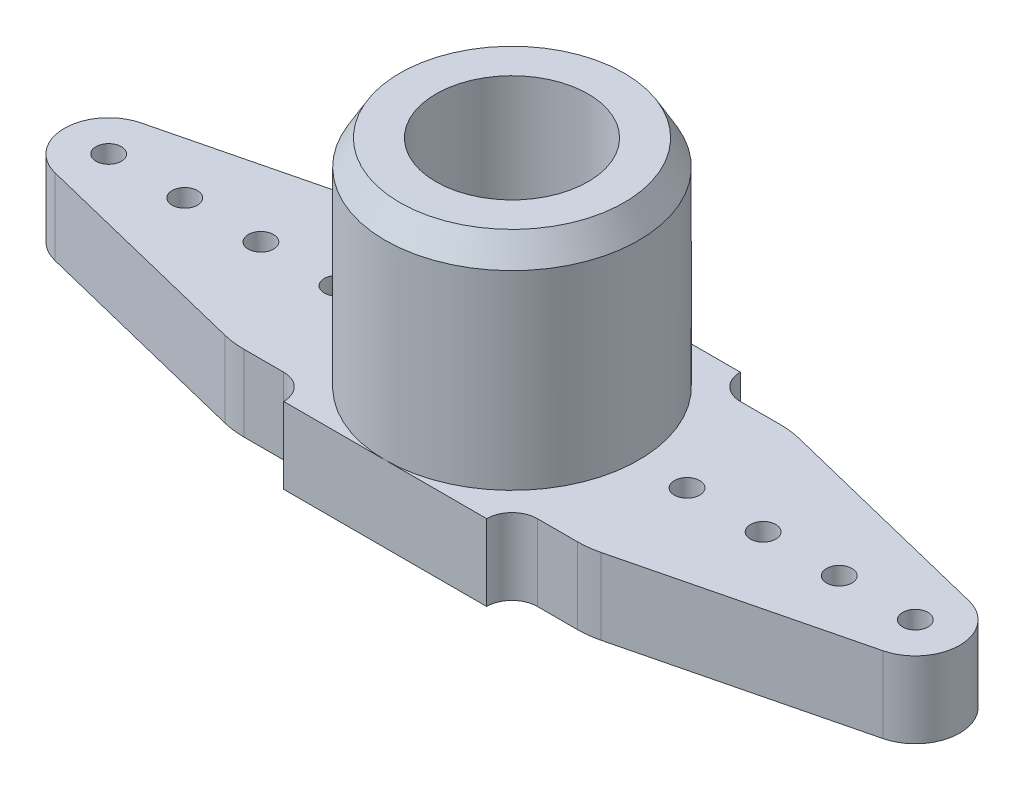
from build123d import *

# Parameters (mm, degrees)
CROQUIS1_R              = 0.5
SALIENTE_EXTRUIR1_DEPTH = 3
MATRIZC1_COUNT          = 4
CROQUIS2_R              = 5
CROQUIS2_R_2            = 3
SALIENTE_EXTRUIR2_DEPTH = 8.5
CHAFL_N1_SIZE           = 1
CHAFL_N1_SIZE2          = 0.577350269
REDONDEO1_R             = 1
CUT_EXTRUDE1_DEPTH      = 10


with BuildPart() as part:
    # Croquis1 → Saliente-Extruir1 (new body)
    with BuildSketch(Plane(origin=(0, 0, 0), x_dir=(1, 0, 0), z_dir=(0, 1, 0))):
        with BuildLine():
            Line((-4, 0), (-4, 6.574293681))
            ThreePointArc((-4, 6.574293681), (-3.974394349, 6.996885575), (-3.897952052, 7.413294188))
            Line((-3.897952052, 7.413294188), (-1.698976026, 16.319147094))
            ThreePointArc((-1.698976026, 16.319147094), (0, 17.649646841), (1.698976026, 16.319147094))
            Line((1.698976026, 16.319147094), (3.897952052, 7.413294188))
            ThreePointArc((3.897952052, 7.413294188), (3.974394349, 6.996885575), (4, 6.574293681))
            Line((4, 6.574293681), (4, 0))
            Line((4, 0), (1.25, 0))
            ThreePointArc((1.25, 0), (0, 1.25), (-1.25, 0))
            Line((-1.25, 0), (-4, 0))
        make_face()
        with Locations(Location((0, 15.899646841, 0), (0, 0, 270))):
            Circle(CROQUIS1_R, mode=Mode.SUBTRACT)
        with Locations(Location((0, 12.899646841, 0), (0, 0, 270))):
            Circle(CROQUIS1_R, mode=Mode.SUBTRACT)
        with Locations(Location((0, 9.899646841, 0), (0, 0, 270))):
            Circle(CROQUIS1_R, mode=Mode.SUBTRACT)
        with Locations(Location((0, 6.899646841, 0), (0, 0, 270))):
            Circle(CROQUIS1_R, mode=Mode.SUBTRACT)
    saliente_extruir1 = extrude(amount=SALIENTE_EXTRUIR1_DEPTH)

    # MatrizC1: Saliente-Extruir1 ×4 about axis
    matrizc1_axis = Axis((0, 0, 0), (0, 1, 0))
    for i in range(1, MATRIZC1_COUNT):
        add(saliente_extruir1.rotate(matrizc1_axis, i * 360 / MATRIZC1_COUNT))

    # Croquis2 → Saliente-Extruir2 (add)
    with BuildSketch(Plane(origin=(0, 3, 0), x_dir=(1, 0, 0), z_dir=(0, 1, 0))):
        with Locations(Location((0, 0, 0), (0, 0, 270))):
            Circle(CROQUIS2_R)
        with Locations(Location((0, 0, 0), (0, 0, 270))):
            Circle(CROQUIS2_R_2, mode=Mode.SUBTRACT)
    extrude(amount=SALIENTE_EXTRUIR2_DEPTH)

    # Chaflán1
    chafl_n1_edges = [part.edges().sort_by_distance(p)[0] for p in [
        (0, 11.5, -5),
    ]]
    chafl_n1_side = [part.faces().sort_by_distance(p)[0] for p in [
        (0, 7.25, -5),
    ]]
    chamfer(chafl_n1_edges, length=CHAFL_N1_SIZE, length2=CHAFL_N1_SIZE2, reference=chafl_n1_side[0])

    # Redondeo1
    redondeo1_edges = [part.edges().sort_by_distance(p)[0] for p in [
        (-4, 1.5, -4),
        (4, 1.5, -4),
        (4, 1.5, 4),
        (-4, 1.5, 4),
    ]]
    fillet(redondeo1_edges, radius=REDONDEO1_R)

    # Sketch1 → Cut-Extrude1 (cut)
    with BuildSketch(Plane.XZ):
        Polygon((4, 5), (-4, 5), (-4, 20.808082072), (5.438258964, 20.808082072), (5.438258964, 5), align=None)
        Polygon((5.438258964, -5), (4, -5), (-4, -5), (-4, -20.808082072), (5.438258964, -20.808082072), align=None)
    extrude(amount=-CUT_EXTRUDE1_DEPTH, mode=Mode.SUBTRACT)


solid = part.part
